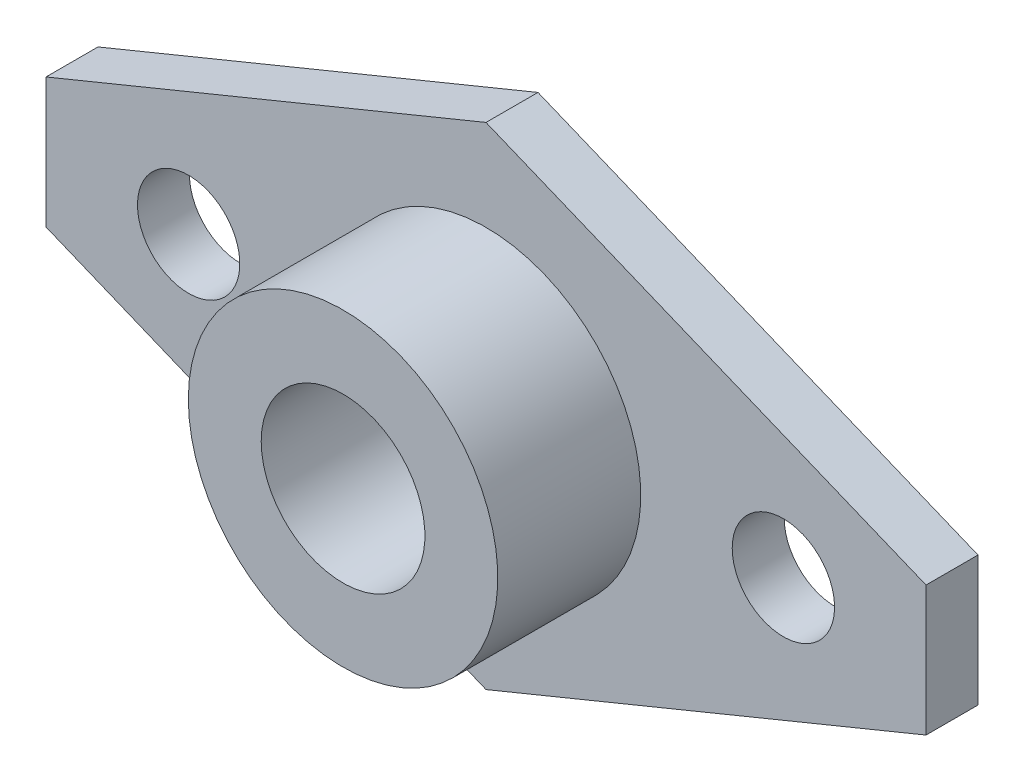
from build123d import *

# Parameters (mm, degrees)
BOSS_EXTRUDE1_DEPTH     = 2.54
SKETCH1_4_R             = 7.560754729
BOSS_EXTRUDE2_DEPTH     = 9.525
CUT_EXTRUDE1_DEPTH      = 27.400295926
CUT_EXTRUDE1_DEPTH_BACK = 9.525
SKETCH1_8_R             = 4
SKETCH1_8_R_2           = 2.5


with BuildPart() as part:
    # Sketch1 → Boss-Extrude1 (new body)
    with BuildSketch(Plane.XY):
        Polygon((-21.5, 3.175), (0, 12), (21.5, 3.175), (21.5, 0), (21.5, -3.175), (0, -12), (-21.5, -3.175), align=None)
    extrude(amount=BOSS_EXTRUDE1_DEPTH)

    # Sketch1<4> → Boss-Extrude2 (add)
    with BuildSketch(Plane.XY):
        Circle(SKETCH1_4_R)
    extrude(amount=BOSS_EXTRUDE2_DEPTH)

    # Sketch1<8> → Cut-Extrude1 (cut, two sides: drawn at the far end of the back side and taken through both)
    with BuildSketch(Plane.XY.offset(-CUT_EXTRUDE1_DEPTH_BACK)):
        Circle(SKETCH1_8_R)
        with Locations((-14.530377365, 0)):
            Circle(SKETCH1_8_R_2)
        with Locations((14.530377365, 0)):
            Circle(SKETCH1_8_R_2)
    extrude(amount=CUT_EXTRUDE1_DEPTH + CUT_EXTRUDE1_DEPTH_BACK, mode=Mode.SUBTRACT)


solid = part.part
